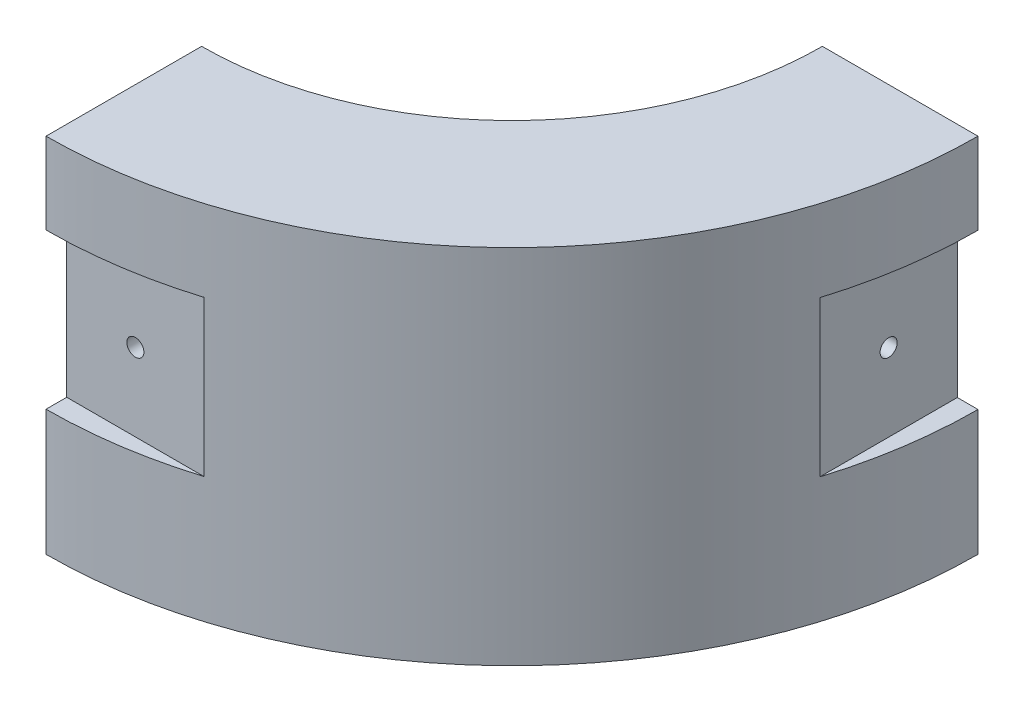
from build123d import *

# Parameters (mm, degrees)
BASE_WALL_DEPTH     = 70
BASE_SUPPORT_START  = -61.5
BASE_SUPPORT_DEPTH  = 61.5
SKETCH4_W           = 8
SKETCH4_H           = 30
MOUNT_NOTCH_DEPTH   = 61.5
SKETCH5_R           = 1.65
SCREW_HOLE_M3_DEPTH = 181.5
SKETCH6_W           = 8
SKETCH6_H           = 30
CUT_EXTRUDE4_DEPTH  = 181.5
SKETCH7_R           = 1.65
CUT_EXTRUDE5_DEPTH  = 181.5


with BuildPart() as part:
    # Sketch1 → Base_Wall (new body)
    with BuildSketch(Plane(origin=(0, 0, 0), x_dir=(1, 0, 0), z_dir=(0, 1, 0))):
        with BuildLine():
            Line((75, 0), (90.075, 0))
            ThreePointArc((90.075, 0), (63.692643315, -63.692643315), (0, -90.075))
            Line((0, -90.075), (0, -75))
            ThreePointArc((0, -75), (53.033008589, -53.033008589), (75, 0))
        make_face()
    extrude(amount=BASE_WALL_DEPTH)

    # Sketch3 → Base_Support (add)
    with BuildSketch(Plane(origin=(0, 70, 0), x_dir=(1, 0, 0), z_dir=(0, 1, 0)).offset(BASE_SUPPORT_START)):
        with BuildLine():
            Line((0, -75), (0, -60))
            ThreePointArc((0, -60), (42.426406871, -42.426406871), (60, 0))
            Line((60, 0), (75, 0))
            ThreePointArc((75, 0), (53.033008589, -53.033008589), (0, -75))
        make_face()
    extrude(amount=BASE_SUPPORT_DEPTH)

    # Sketch4 → Mount-Notch (cut)
    with BuildSketch(Plane(origin=(0, 0, 0), x_dir=(-1, 0, 0), z_dir=(0, 0, -1))):
        with Locations((-90.075, 39.25)):
            Rectangle(SKETCH4_W, SKETCH4_H)
    extrude(amount=-MOUNT_NOTCH_DEPTH, mode=Mode.SUBTRACT)

    # Sketch5 → Screw-Hole-M3 (cut)
    with BuildSketch(Plane(origin=(0, 0, 0), x_dir=(0, 0, -1), z_dir=(1, 0, 0))):
        with Locations(Location((-13.272151295, 39.25, 0), (0, 0, 180))):
            Circle(SKETCH5_R)
    extrude(amount=SCREW_HOLE_M3_DEPTH, mode=Mode.SUBTRACT)

    # Sketch6 → Cut-Extrude4 (cut)
    with BuildSketch(Plane.ZY):
        with Locations((90.075, 39.294262642)):
            Rectangle(SKETCH6_W, SKETCH6_H)
    extrude(amount=-CUT_EXTRUDE4_DEPTH, mode=Mode.SUBTRACT)

    # Sketch7 → Cut-Extrude5 (cut)
    with BuildSketch(Plane.XY.offset(86.075)):
        with Locations((13.272151295, 39.294262642)):
            Circle(SKETCH7_R)
    extrude(amount=-CUT_EXTRUDE5_DEPTH, mode=Mode.SUBTRACT)


solid = part.part
